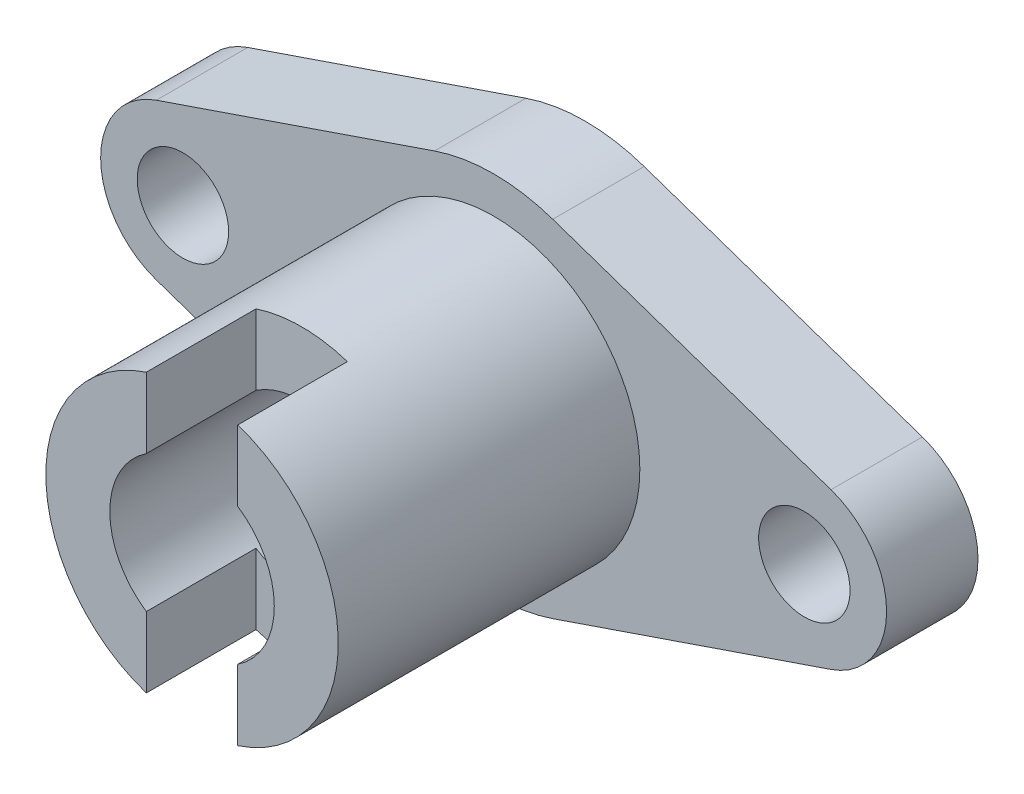
from build123d import *

# Parameters (mm, degrees)
EXTRUDE_1_DEPTH          = 10
SKETCH_3_R               = 5
CUT_EXTRUDE_1_DEPTH      = 10
SKETCH_4_R               = 16
EXTRUDE_2_DEPTH          = 33
SKETCH_5_R               = 9
CUT_EXTRUDE_2_DEPTH      = 89
CUT_EXTRUDE_3_DEPTH      = 89
CUT_EXTRUDE_3_DEPTH_BACK = 89
SKETCH_6_W               = 10
SKETCH_6_H               = 12


with BuildPart() as part:
    # 草图1 → 凸台-拉伸1 (new body)
    with BuildSketch(Plane.XY):
        with BuildLine():
            Line((-36.911764706, 8.515963028), (-6.470588235, 18.924362285))
            ThreePointArc((-6.470588235, 18.924362285), (0, 20), (6.470588235, 18.924362285))
            Line((6.470588235, 18.924362285), (36.911764706, 8.515963028))
            ThreePointArc((36.911764706, 8.515963028), (43, 0), (36.911764706, -8.515963028))
            Line((36.911764706, -8.515963028), (6.470588235, -18.924362285))
            ThreePointArc((6.470588235, -18.924362285), (0, -20), (-6.470588235, -18.924362285))
            Line((-6.470588235, -18.924362285), (-36.911764706, -8.515963028))
            ThreePointArc((-36.911764706, -8.515963028), (-43, 0), (-36.911764706, 8.515963028))
        make_face()
    extrude(amount=EXTRUDE_1_DEPTH)

    # 草图3 → 切除-拉伸1 (cut)
    with BuildSketch(Plane.XY):
        with Locations((-34, 0)):
            Circle(SKETCH_3_R)
        with Locations((34, 0)):
            Circle(SKETCH_3_R)
    extrude(amount=CUT_EXTRUDE_1_DEPTH, mode=Mode.SUBTRACT)

    # 草图4 → 凸台-拉伸2 (add)
    with BuildSketch(Plane.XY.offset(10)):
        Circle(SKETCH_4_R)
    extrude(amount=EXTRUDE_2_DEPTH)

    # 草图5 → 切除-拉伸2 (cut)
    with BuildSketch(Plane.XY.offset(43)):
        Circle(SKETCH_5_R)
    extrude(amount=-CUT_EXTRUDE_2_DEPTH, mode=Mode.SUBTRACT)

    # 草图6 → 切除-拉伸3 (cut, two sides: drawn at the far end of the back side and taken through both)
    with BuildSketch(Plane(origin=(0, 0, 0), x_dir=(1, 0, 0), z_dir=(0, 1, 0)).offset(-CUT_EXTRUDE_3_DEPTH_BACK)):
        with Locations((0, -37)):
            Rectangle(SKETCH_6_W, SKETCH_6_H)
    extrude(amount=CUT_EXTRUDE_3_DEPTH + CUT_EXTRUDE_3_DEPTH_BACK, mode=Mode.SUBTRACT)


solid = part.part
